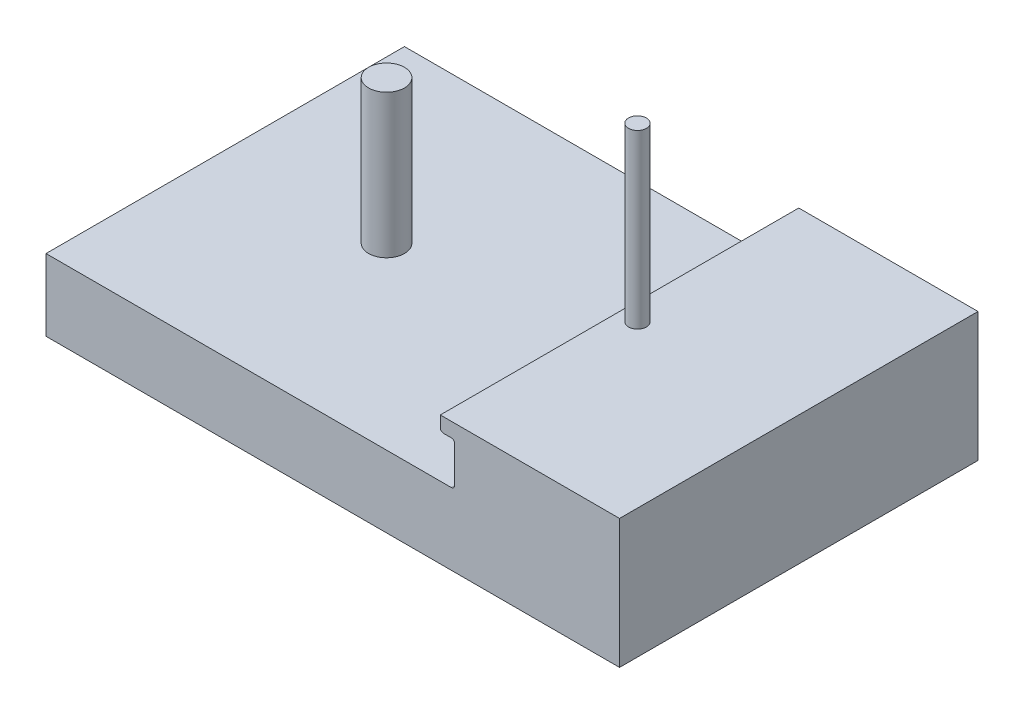
from build123d import *

# Parameters (mm, degrees)
SKETCH_1_W          = 80
SKETCH_1_H          = 50
EXTRUDE_1_DEPTH     = 10
SKETCH_2_R          = 2.5
SKETCH_2_R_2        = 1.25
EXTRUDE_2_DEPTH     = 20
SKETCH_4_W          = 25
SKETCH_4_H          = 50
EXTRUDE_3_DEPTH     = 8
SKETCH_5_R          = 1.25
EXTRUDE_4_DEPTH     = 12
CUT_EXTRUDE_1_DEPTH = 77.576758876


with BuildPart() as part:
    # 草圖1 → 填料-伸長1 (new body)
    with BuildSketch(Plane(origin=(0, 0, 0), x_dir=(1, 0, 0), z_dir=(0, 1, 0))):
        Rectangle(SKETCH_1_W, SKETCH_1_H)
    extrude(amount=EXTRUDE_1_DEPTH)

    # 草圖2 → 填料-伸長2 (add)
    with BuildSketch(Plane(origin=(0, 10, 0), x_dir=(1, 0, 0), z_dir=(0, 1, 0))):
        with Locations(Location((-17.5, 0, 0), (0, 0, 270))):
            Circle(SKETCH_2_R)
        with Locations(Location((17.5, 0, 0), (0, 0, 270))):
            Circle(SKETCH_2_R_2)
    extrude(amount=EXTRUDE_2_DEPTH)

    # 草圖4 → 填料-伸長3 (add)
    with BuildSketch(Plane(origin=(0, 10, 0), x_dir=(1, 0, 0), z_dir=(0, 1, 0))):
        with Locations((27.5, 0)):
            Rectangle(SKETCH_4_W, SKETCH_4_H)
    extrude(amount=EXTRUDE_3_DEPTH)

    # 草圖5 → 填料-伸長4 (add)
    with BuildSketch(Plane(origin=(0, 30, 0), x_dir=(1, 0, 0), z_dir=(0, 1, 0))):
        with Locations(Location((17.5, 0, 0), (0, 0, 90))):
            Circle(SKETCH_5_R)
    extrude(amount=EXTRUDE_4_DEPTH)

    # 草圖7 → 除料-伸長1 (cut, through all)
    with BuildSketch(Plane(origin=(0, 0, -25), x_dir=(-1, 0, 0), z_dir=(0, 0, -1))):
        with BuildLine():
            Line((-15.473976981, 16), (-16.526023019, 16))
            ThreePointArc((-16.526023019, 16), (-16.861175356, 15.861175356), (-17, 15.526023019))
            Line((-17, 15.526023019), (-17, 10.473976981))
            ThreePointArc((-17, 10.473976981), (-16.861175356, 10.138824644), (-16.526023019, 10))
            Line((-16.526023019, 10), (-15, 10))
            Line((-15, 10), (-14.5, 10))
            Line((-14.5, 10), (-14.5, 18))
            Line((-14.5, 18), (-15, 18))
            Line((-15, 18), (-15, 16.473976981))
            ThreePointArc((-15, 16.473976981), (-15.138824644, 16.138824644), (-15.473976981, 16))
        make_face()
    extrude(amount=-CUT_EXTRUDE_1_DEPTH, mode=Mode.SUBTRACT)


solid = part.part
